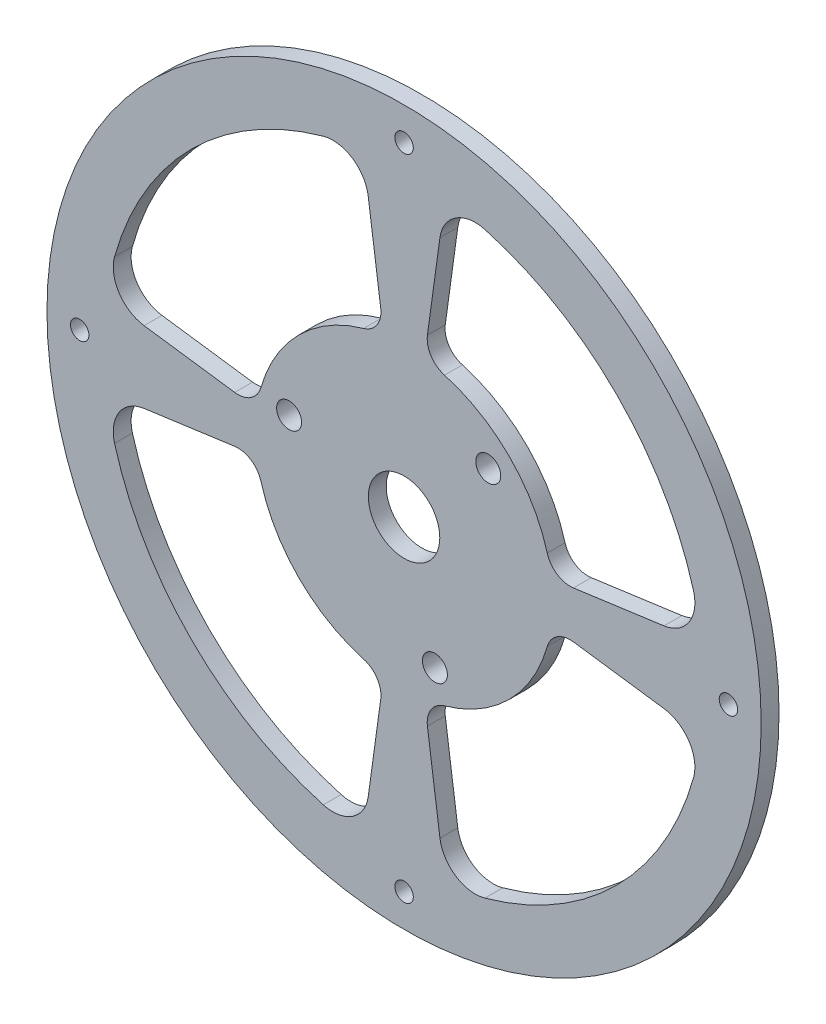
from build123d import *

# Parameters (mm, degrees)
SKETCH_1_R      = 60
SKETCH_1_R_2    = 1.55
SKETCH_1_R_3    = 2.1
SKETCH_1_R_4    = 6
EXTRUDE_1_DEPTH = 3


with BuildPart() as part:
    # 草图1 → 凸台-拉伸1 (new body)
    with BuildSketch(Plane.XY):
        Circle(SKETCH_1_R)
        with Locations((0, 54.5)):
            Circle(SKETCH_1_R_2, mode=Mode.SUBTRACT)
        with Locations((-54.5, 0)):
            Circle(SKETCH_1_R_2, mode=Mode.SUBTRACT)
        with Locations((0, -54.5)):
            Circle(SKETCH_1_R_2, mode=Mode.SUBTRACT)
        with Locations((54.5, 0)):
            Circle(SKETCH_1_R_2, mode=Mode.SUBTRACT)
        with Locations((14.142135624, 14.142135624)):
            Circle(SKETCH_1_R_3, mode=Mode.SUBTRACT)
        with Locations((5.176380902, -19.318516526)):
            Circle(SKETCH_1_R_3, mode=Mode.SUBTRACT)
        with Locations((-19.318516526, 5.176380902)):
            Circle(SKETCH_1_R_3, mode=Mode.SUBTRACT)
        Circle(SKETCH_1_R_4, mode=Mode.SUBTRACT)
        with BuildLine():
            Line((3.923217687, -28.453617749), (6.022703538, -43.680396542))
            ThreePointArc((6.022703538, -43.680396542), (8.67451724, -47.877141015), (13.579927123, -48.639855873))
            ThreePointArc((13.579927123, -48.639855873), (35.70889245, -35.70889245), (48.639855873, -13.579927123))
            ThreePointArc((48.639855873, -13.579927123), (47.877141015, -8.67451724), (43.680396542, -6.022703538))
            Line((43.680396542, -6.022703538), (28.453617749, -3.923217687))
            ThreePointArc((28.453617749, -3.923217687), (25.717860997, -4.538114468), (24.057984584, -6.7980422))
            ThreePointArc((24.057984584, -6.7980422), (17.67766953, -17.67766953), (6.7980422, -24.057984584))
            ThreePointArc((6.7980422, -24.057984584), (4.538114468, -25.717860997), (3.923217687, -28.453617749))
        make_face(mode=Mode.SUBTRACT)
        with BuildLine():
            Line((28.453617749, 3.923217687), (43.680396542, 6.022703538))
            ThreePointArc((43.680396542, 6.022703538), (47.877141015, 8.67451724), (48.639855873, 13.579927123))
            ThreePointArc((48.639855873, 13.579927123), (35.70889245, 35.70889245), (13.579927123, 48.639855873))
            ThreePointArc((13.579927123, 48.639855873), (8.67451724, 47.877141015), (6.022703538, 43.680396542))
            Line((6.022703538, 43.680396542), (3.923217687, 28.453617749))
            ThreePointArc((3.923217687, 28.453617749), (4.538114468, 25.717860997), (6.7980422, 24.057984584))
            ThreePointArc((6.7980422, 24.057984584), (17.67766953, 17.67766953), (24.057984584, 6.7980422))
            ThreePointArc((24.057984584, 6.7980422), (25.717860997, 4.538114468), (28.453617749, 3.923217687))
        make_face(mode=Mode.SUBTRACT)
        with BuildLine():
            Line((-28.453617749, -3.923217687), (-43.680396542, -6.022703538))
            ThreePointArc((-43.680396542, -6.022703538), (-47.877141015, -8.67451724), (-48.639855873, -13.579927123))
            ThreePointArc((-48.639855873, -13.579927123), (-35.70889245, -35.70889245), (-13.579927123, -48.639855873))
            ThreePointArc((-13.579927123, -48.639855873), (-8.67451724, -47.877141015), (-6.022703538, -43.680396542))
            Line((-6.022703538, -43.680396542), (-3.923217687, -28.453617749))
            ThreePointArc((-3.923217687, -28.453617749), (-4.538114468, -25.717860997), (-6.7980422, -24.057984584))
            ThreePointArc((-6.7980422, -24.057984584), (-17.67766953, -17.67766953), (-24.057984584, -6.7980422))
            ThreePointArc((-24.057984584, -6.7980422), (-25.717860997, -4.538114468), (-28.453617749, -3.923217687))
        make_face(mode=Mode.SUBTRACT)
        with BuildLine():
            Line((-3.923217687, 28.453617749), (-6.022703538, 43.680396542))
            ThreePointArc((-6.022703538, 43.680396542), (-8.67451724, 47.877141015), (-13.579927123, 48.639855873))
            ThreePointArc((-13.579927123, 48.639855873), (-35.70889245, 35.70889245), (-48.639855873, 13.579927123))
            ThreePointArc((-48.639855873, 13.579927123), (-47.877141015, 8.67451724), (-43.680396542, 6.022703538))
            Line((-43.680396542, 6.022703538), (-28.453617749, 3.923217687))
            ThreePointArc((-28.453617749, 3.923217687), (-25.717860997, 4.538114468), (-24.057984584, 6.7980422))
            ThreePointArc((-24.057984584, 6.7980422), (-17.67766953, 17.67766953), (-6.7980422, 24.057984584))
            ThreePointArc((-6.7980422, 24.057984584), (-4.538114468, 25.717860997), (-3.923217687, 28.453617749))
        make_face(mode=Mode.SUBTRACT)
    extrude(amount=EXTRUDE_1_DEPTH)


solid = part.part
